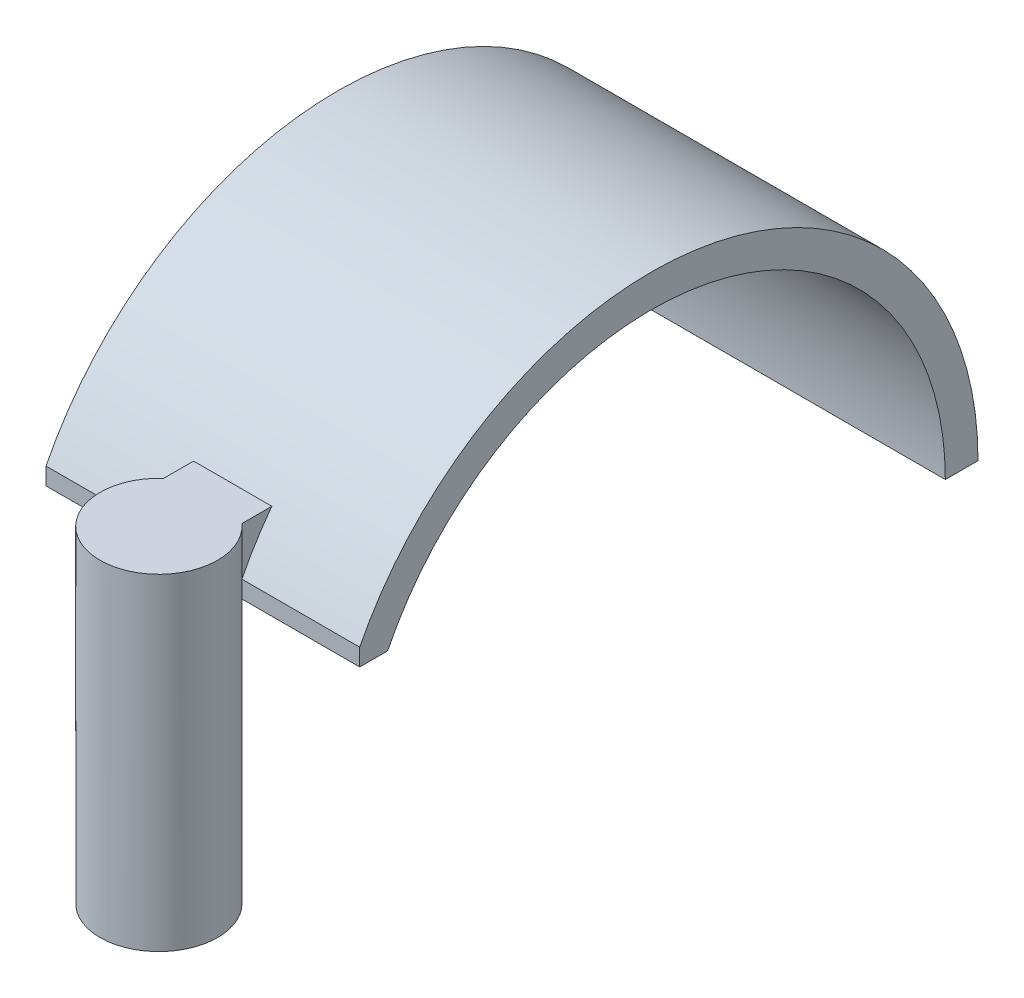
from build123d import *

# Parameters (mm, degrees)
SKETCH1_R                = 5.715
BOSS_EXTRUDE1_DEPTH      = 25.4
BOSS_EXTRUDE3_DEPTH      = 6.35
BOSS_EXTRUDE4_DEPTH      = 11.430000000000001
BOSS_EXTRUDE4_DEPTH_BACK = 19.05
CUT_EXTRUDE1_START       = -19.05
SKETCH5_R                = 28.575000000000006
CUT_EXTRUDE1_DEPTH       = 19.05


with BuildPart() as part:
    # Sketch1 → Boss-Extrude1 (new body)
    with BuildSketch(Plane(origin=(0, 0, 0), x_dir=(1, 0, 0), z_dir=(0, 1, 0))):
        with Locations(Location((0, 0, 0), (0, 0, 270))):
            Circle(SKETCH1_R)
        with BuildLine():
            Line((3.801523904962324, -2.54), (-3.801523904962324, -2.54))
            ThreePointArc((-3.8015239049623246, -2.5400000000000005), (-1.33e-15, 4.572000000000001), (3.801523904962326, -2.5399999999999983))
        make_face(mode=Mode.SUBTRACT)
    extrude(amount=BOSS_EXTRUDE1_DEPTH)

    # Sketch2 → Boss-Extrude3 (add)
    with BuildSketch(Plane(origin=(0, 25.4, 0), x_dir=(1, 0, 0), z_dir=(0, 1, 0))):
        with BuildLine():
            Line((3.801523904962324, -2.54), (-3.801523904962324, -2.54))
            ThreePointArc((-3.8015239049623246, -2.5400000000000005), (-4.572, 5.607e-14), (-3.801523904962262, 2.540000000000094))
            Line((-3.801523904962324, 2.540000000000111), (-3.801523904962324, 4.267275594568456))
            ThreePointArc((-3.801523904962365, 4.26727559456847), (-2.338323746098912, -5.214735569367823), (5.715, -1.4e-15))
            ThreePointArc((5.715, 0), (5.214735569367823, 2.338323746098912), (3.801523904962363, 4.267275594568472))
            Line((3.801523904962324, 4.267275594568458), (3.801523904962324, 2.5400000000001137))
            ThreePointArc((3.801523904962324, 2.540000000000001), (4.572000000000001, 1.44e-15), (3.801523904962326, -2.5399999999999983))
        make_face()
        with BuildLine():
            Line((-3.801523904962324, 2.540000000000111), (-3.801523904962324, -2.54))
            Line((-3.801523904962324, -2.54), (3.801523904962324, -2.54))
            Line((3.801523904962324, -2.54), (3.801523904962324, 2.5400000000001137))
            ThreePointArc((3.801523904962324, 2.540000000000001), (5.507e-14, 4.572000000000001), (-3.801523904962262, 2.540000000000094))
        make_face()
        with BuildLine():
            Line((-3.801523904962324, 32.590628837493085), (-3.801523904962324, 4.267275594568456))
            ThreePointArc((-3.801523904962365, 4.26727559456847), (-2.19e-15, 5.715), (3.801523904962363, 4.267275594568472))
            Line((3.801523904962324, 4.267275594568458), (3.801523904962324, 32.590628837493085))
            Line((3.801523904962324, 32.590628837493085), (-3.801523904962324, 32.590628837493085))
        make_face()
        with BuildLine():
            Line((-3.801523904962324, 4.267275594568456), (-3.801523904962324, 2.540000000000111))
            ThreePointArc((-3.801523904962262, 2.540000000000094), (5.507e-14, 4.572000000000001), (3.801523904962324, 2.540000000000001))
            Line((3.801523904962324, 2.5400000000001137), (3.801523904962324, 4.267275594568458))
            ThreePointArc((3.801523904962363, 4.267275594568472), (-2.19e-15, 5.715), (-3.801523904962365, 4.26727559456847))
        make_face()
        with BuildLine():
            ThreePointArc((-3.801523904962262, 2.540000000000094), (-4.572, 5.607e-14), (-3.8015239049623246, -2.5400000000000005))
            Line((-3.801523904962324, -2.54), (-3.801523904962324, 2.540000000000111))
        make_face()
        with BuildLine():
            Line((3.801523904962324, 2.5400000000001137), (3.801523904962324, -2.54))
            ThreePointArc((3.801523904962326, -2.5399999999999983), (4.572000000000001, 1.44e-15), (3.801523904962324, 2.540000000000001))
        make_face()
    extrude(amount=BOSS_EXTRUDE3_DEPTH)

    # Sketch4 → Boss-Extrude4 (add, two sides: drawn at the far end of the back side and taken through both)
    with BuildSketch(Plane.ZY.offset(3.801523904962324).offset(-BOSS_EXTRUDE4_DEPTH_BACK)):
        with BuildLine():
            Line((-64.34062883749309, 12.723017723708097), (-61.16562883749309, 12.723017723708097))
            ThreePointArc((-61.16562883749309, 12.7230177237081), (-42.772401198467776, 39.4224959318921), (-11.27151604034228, 31.75000000000092))
            Line((-11.271516040342593, 31.75), (-7.173381829650392, 31.75))
            ThreePointArc((-7.173381829650484, 31.74999999999974), (-42.61721618067714, 42.8482570795954), (-64.34062883749309, 12.7230177237081))
        make_face()
        with BuildLine():
            Line((-7.173381829650392, 31.75), (-11.271516040342593, 31.75))
            ThreePointArc((-11.27151604034228, 31.75000000000092), (-8.912699493419062, 28.719463797040717), (-6.981553388219599, 25.39999999999997))
            Line((-6.9815533882195915, 25.4), (-4.267275594568506, 25.4))
            Line((-4.267275594568505, 25.4), (-4.267275594568505, 27.07049698232741))
            ThreePointArc((-4.267275594568467, 27.07049698232742), (-5.618653271152166, 29.473391870237137), (-7.173381829650484, 31.74999999999974))
        make_face()
    extrude(amount=BOSS_EXTRUDE4_DEPTH + BOSS_EXTRUDE4_DEPTH_BACK)

    # Sketch5 → Cut-Extrude1 (cut)
    with BuildSketch(Plane.ZY.offset(3.801523904962324).offset(CUT_EXTRUDE1_START)):
        with Locations((-32.590628837493085, 12.723017723708097)):
            Circle(SKETCH5_R)
    extrude(amount=CUT_EXTRUDE1_DEPTH, mode=Mode.SUBTRACT)


solid = part.part
